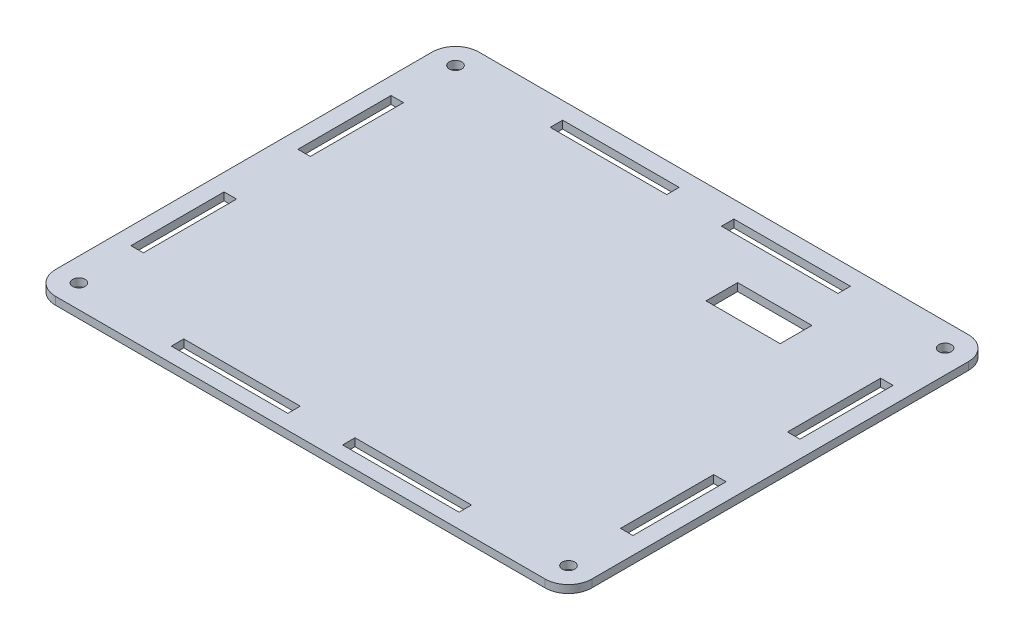
from build123d import *

# Parameters (mm, degrees)
SKETCH1_W           = 138.1
SKETCH1_H           = 109
SKETCH1_R           = 1.6
SKETCH1_W_2         = 30
SKETCH1_H_2         = 3.2
SKETCH1_W_3         = 3.2
SKETCH1_H_3         = 24
SKETCH1_W_4         = 19.101
SKETCH1_H_4         = 8.153
BOSS_EXTRUDE1_DEPTH = 2
FILLET1_R           = 6
FILLET2_R           = 6
FILLET3_R           = 6


with BuildPart() as part:
    # Sketch1 → Boss-Extrude1 (new body)
    with BuildSketch(Plane(origin=(0, 0, 0), x_dir=(1, 0, 0), z_dir=(0, 1, 0))):
        with Locations((69.05, 54.5)):
            Rectangle(SKETCH1_W, SKETCH1_H)
        with Locations(Location((6, 103, 0), (0, 0, 270))):
            Circle(SKETCH1_R, mode=Mode.SUBTRACT)
        with Locations(Location((132.1, 103, 0), (0, 0, 270))):
            Circle(SKETCH1_R, mode=Mode.SUBTRACT)
        with Locations(Location((132.1, 6, 0), (0, 0, 270))):
            Circle(SKETCH1_R, mode=Mode.SUBTRACT)
        with Locations(Location((6, 6, 0), (0, 0, 270))):
            Circle(SKETCH1_R, mode=Mode.SUBTRACT)
        with Locations((47, 5.414130674)):
            Rectangle(SKETCH1_W_2, SKETCH1_H_2, mode=Mode.SUBTRACT)
        with Locations((47, 103)):
            Rectangle(SKETCH1_W_2, SKETCH1_H_2, mode=Mode.SUBTRACT)
        with Locations((91.1, 103)):
            Rectangle(SKETCH1_W_2, SKETCH1_H_2, mode=Mode.SUBTRACT)
        with Locations((91.1, 5.414130674)):
            Rectangle(SKETCH1_W_2, SKETCH1_H_2, mode=Mode.SUBTRACT)
        with Locations((6, 76)):
            Rectangle(SKETCH1_W_3, SKETCH1_H_3, mode=Mode.SUBTRACT)
        with Locations((6, 33)):
            Rectangle(SKETCH1_W_3, SKETCH1_H_3, mode=Mode.SUBTRACT)
        with Locations((132.1, 76)):
            Rectangle(SKETCH1_W_3, SKETCH1_H_3, mode=Mode.SUBTRACT)
        with Locations((132.1, 33)):
            Rectangle(SKETCH1_W_3, SKETCH1_H_3, mode=Mode.SUBTRACT)
        with Locations((100.3195, 86.8275)):
            Rectangle(SKETCH1_W_4, SKETCH1_H_4, mode=Mode.SUBTRACT)
    extrude(amount=BOSS_EXTRUDE1_DEPTH)

    # Fillet1
    fillet1_edges = [part.edges().sort_by_distance(p)[0] for p in [
        (0, 1, -109),
    ]]
    fillet(fillet1_edges, radius=FILLET1_R)

    # Fillet2
    fillet2_edges = [part.edges().sort_by_distance(p)[0] for p in [
        (0, 1, 0),
    ]]
    fillet(fillet2_edges, radius=FILLET2_R)

    # Fillet3
    fillet3_edges = [part.edges().sort_by_distance(p)[0] for p in [
        (138.1, 1, -109),
        (138.1, 1, 0),
    ]]
    fillet(fillet3_edges, radius=FILLET3_R)


solid = part.part
